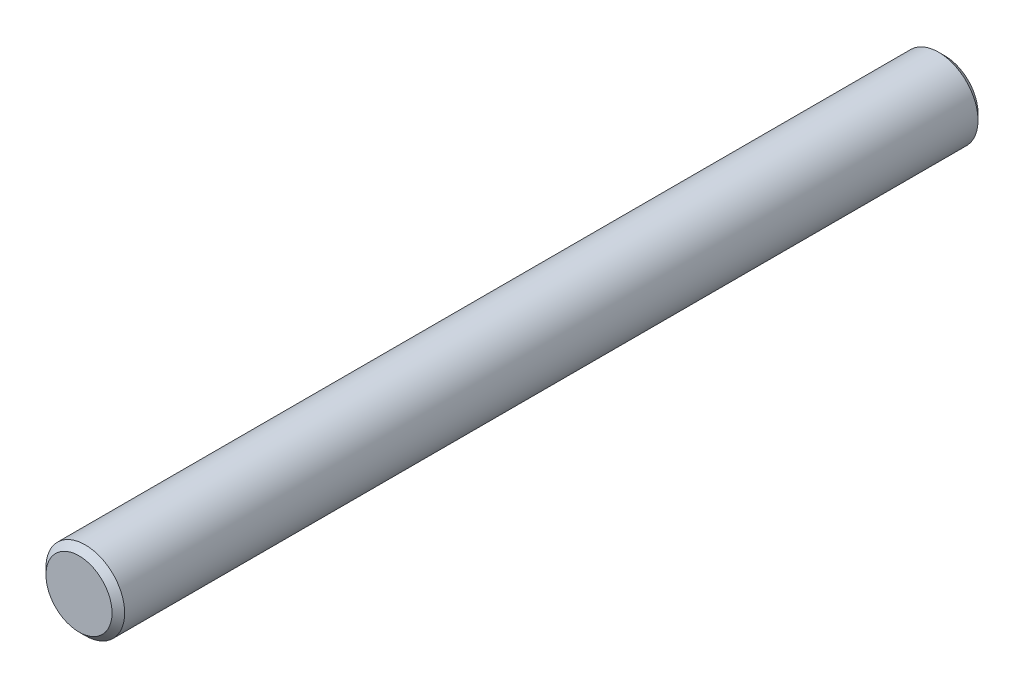
from build123d import *

# Parameters (mm, degrees)
SKETCH1_R           = 3.175
BOSS_EXTRUDE2_DEPTH = 69.85
CHAMFER2_SIZE       = 0.508


with BuildPart() as part:
    # Sketch1 → Boss-Extrude2 (new body)
    with BuildSketch(Plane.XY):
        Circle(SKETCH1_R)
    extrude(amount=BOSS_EXTRUDE2_DEPTH)

    # Chamfer2
    chamfer2_edges = [part.edges().sort_by_distance(p)[0] for p in [
        (-3.175, 0, 0),
        (-3.175, 0, 69.85),
    ]]
    chamfer(chamfer2_edges, length=CHAMFER2_SIZE)


solid = part.part
